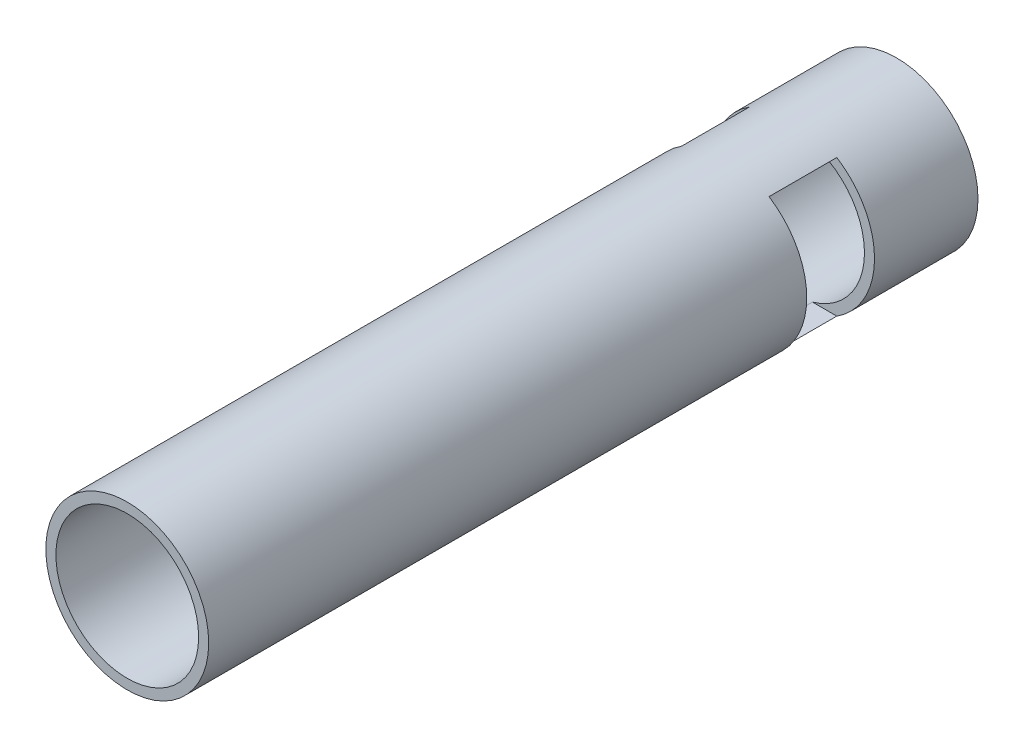
from build123d import *

# Parameters (mm, degrees)
SKETCH1_R               = 44.45
SKETCH1_R_2             = 38.9636
BOSS_EXTRUDE1_DEPTH     = 420
CUT_EXTRUDE1_DEPTH      = 50
CUT_EXTRUDE1_DEPTH_BACK = 50
SKETCH3_W               = 37
SKETCH3_H               = 75


with BuildPart() as part:
    # Sketch1 → Boss-Extrude1 (new body)
    with BuildSketch(Plane.XY):
        Circle(SKETCH1_R)
        Circle(SKETCH1_R_2, mode=Mode.SUBTRACT)
    extrude(amount=BOSS_EXTRUDE1_DEPTH)

    # Sketch3 → Cut-Extrude1 (cut, two sides: drawn at the far end of the back side and taken through both)
    with BuildSketch(Plane(origin=(0, 0, 0), x_dir=(0, 0, -1), z_dir=(1, 0, 0)).offset(-CUT_EXTRUDE1_DEPTH_BACK)):
        with Locations((-75, 0)):
            Rectangle(SKETCH3_W, SKETCH3_H)
    extrude(amount=CUT_EXTRUDE1_DEPTH + CUT_EXTRUDE1_DEPTH_BACK, mode=Mode.SUBTRACT)


solid = part.part
